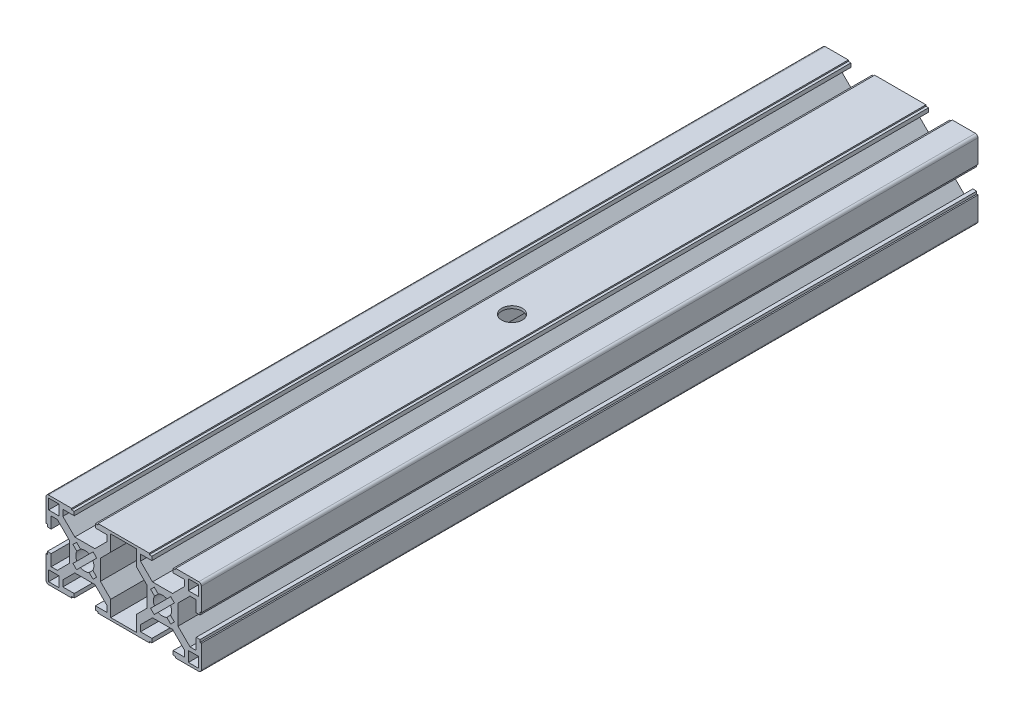
from build123d import *

# Parameters (mm, degrees)
ESBO_O1_W                      = 4
ESBO_O1_H                      = 4
RESSALTO_EXTRUS_O1_DEPTH       = 300
PADR_OCIRCULAR1_COUNT          = 4
PADR_O_LINEAR1_COUNT           = 2
PADR_O_LINEAR1_PITCH           = 30
PADR_O_LINEAR1_COPY_1_SKETCH_W = 4
PADR_O_LINEAR1_COPY_1_SKETCH_H = 4
PADR_O_LINEAR1_COPY_1_DEPTH    = 300
PADR_O_LINEAR1_COPY_2_SKETCH_W = 4
PADR_O_LINEAR1_COPY_2_SKETCH_H = 4
PADR_O_LINEAR1_COPY_2_DEPTH    = 300
PADR_O_LINEAR1_COPY_3_SKETCH_W = 4
PADR_O_LINEAR1_COPY_3_SKETCH_H = 4
PADR_O_LINEAR1_COPY_3_DEPTH    = 300
ESBO_O4_W                      = 10
ESBO_O4_H                      = 28
CORTE_EXTRUS_O1_DEPTH          = 304.72685097
FILETE1_R                      = 1
CUT_EXTRUDE1_DEPTH             = 305.836021494


with BuildPart() as part:
    # Esboço1 → Ressalto-extrusão1 (new body)
    with BuildSketch(Plane.XY):
        with BuildLine():
            ThreePointArc((-1.664601464, 3.078815026), (-0.858529967, 3.393070335), (0, 3.5))
            Line((0, 3.5), (0, 6))
            Line((0, 6), (-3.878679656, 6))
            Line((-3.878679656, 6), (-8.5, 10.621320344))
            Line((-8.5, 10.621320344), (-8.5, 13))
            Line((-8.5, 13), (-4.1, 13))
            Line((-4.1, 13), (-4.1, 14.5))
            Line((-4.1, 14.5), (-5.1, 14.5))
            Line((-5.1, 14.5), (-5.1, 15))
            Line((-5.1, 15), (-15, 15))
            Line((-15, 15), (-15, 5.1))
            Line((-15, 5.1), (-14.5, 5.1))
            Line((-14.5, 5.1), (-14.5, 4.1))
            Line((-14.5, 4.1), (-13, 4.1))
            Line((-13, 4.1), (-13, 8.5))
            Line((-13, 8.5), (-10.621320344, 8.5))
            Line((-10.621320344, 8.5), (-6, 3.878679656))
            Line((-6, 3.878679656), (-6, 0))
            Line((-6, 0), (-3.5, 0))
            ThreePointArc((-3.5, 0), (-3.393070335, 0.858529967), (-3.078815026, 1.664601464))
            Line((-3.078815026, 1.664601464), (-4.596194078, 3.181980515))
            Line((-4.596194078, 3.181980515), (-3.181980515, 4.596194078))
            Line((-3.181980515, 4.596194078), (-1.664601464, 3.078815026))
        make_face()
        with Locations((-12, 12)):
            Rectangle(ESBO_O1_W, ESBO_O1_H, mode=Mode.SUBTRACT)
    ressalto_extrus_o1 = extrude(amount=RESSALTO_EXTRUS_O1_DEPTH)

    # PadrãoCircular1: Ressalto-extrusão1 ×4 about axis
    padr_ocircular1_axis = Axis((0, 0, 0), (0, 0, 1))
    for i in range(1, PADR_OCIRCULAR1_COUNT):
        add(ressalto_extrus_o1.rotate(padr_ocircular1_axis, i * 360 / PADR_OCIRCULAR1_COUNT))

    # Padrão linear1: Ressalto-extrusão1 ×2
    with Locations(*[(i * PADR_O_LINEAR1_PITCH, 0, 0) for i in range(1, PADR_O_LINEAR1_COUNT)]):
        add(ressalto_extrus_o1)

    # Padrão linear1 copy 1 sketch → Padrão linear1 copy 1 (add)
    with BuildSketch(Plane(origin=(30, 0, 0), x_dir=(0, 1, 0), z_dir=(0, 0, 1))):
        with BuildLine():
            ThreePointArc((-1.664601464, 3.078815026), (-0.858529967, 3.393070335), (0, 3.5))
            Line((0, 3.5), (0, 6))
            Line((0, 6), (-3.878679656, 6))
            Line((-3.878679656, 6), (-8.5, 10.621320344))
            Line((-8.5, 10.621320344), (-8.5, 13))
            Line((-8.5, 13), (-4.1, 13))
            Line((-4.1, 13), (-4.1, 14.5))
            Line((-4.1, 14.5), (-5.1, 14.5))
            Line((-5.1, 14.5), (-5.1, 15))
            Line((-5.1, 15), (-15, 15))
            Line((-15, 15), (-15, 5.1))
            Line((-15, 5.1), (-14.5, 5.1))
            Line((-14.5, 5.1), (-14.5, 4.1))
            Line((-14.5, 4.1), (-13, 4.1))
            Line((-13, 4.1), (-13, 8.5))
            Line((-13, 8.5), (-10.621320344, 8.5))
            Line((-10.621320344, 8.5), (-6, 3.878679656))
            Line((-6, 3.878679656), (-6, 0))
            Line((-6, 0), (-3.5, 0))
            ThreePointArc((-3.5, 0), (-3.393070335, 0.858529967), (-3.078815026, 1.664601464))
            Line((-3.078815026, 1.664601464), (-4.596194078, 3.181980515))
            Line((-4.596194078, 3.181980515), (-3.181980515, 4.596194078))
            Line((-3.181980515, 4.596194078), (-1.664601464, 3.078815026))
        make_face()
        with Locations((-12, 12)):
            Rectangle(PADR_O_LINEAR1_COPY_1_SKETCH_W, PADR_O_LINEAR1_COPY_1_SKETCH_H, mode=Mode.SUBTRACT)
    extrude(amount=PADR_O_LINEAR1_COPY_1_DEPTH)

    # Padrão linear1 copy 2 sketch → Padrão linear1 copy 2 (add)
    with BuildSketch(Plane(origin=(30, 0, 0), x_dir=(-1, 0, 0), z_dir=(0, 0, 1))):
        with BuildLine():
            ThreePointArc((-1.664601464, 3.078815026), (-0.858529967, 3.393070335), (0, 3.5))
            Line((0, 3.5), (0, 6))
            Line((0, 6), (-3.878679656, 6))
            Line((-3.878679656, 6), (-8.5, 10.621320344))
            Line((-8.5, 10.621320344), (-8.5, 13))
            Line((-8.5, 13), (-4.1, 13))
            Line((-4.1, 13), (-4.1, 14.5))
            Line((-4.1, 14.5), (-5.1, 14.5))
            Line((-5.1, 14.5), (-5.1, 15))
            Line((-5.1, 15), (-15, 15))
            Line((-15, 15), (-15, 5.1))
            Line((-15, 5.1), (-14.5, 5.1))
            Line((-14.5, 5.1), (-14.5, 4.1))
            Line((-14.5, 4.1), (-13, 4.1))
            Line((-13, 4.1), (-13, 8.5))
            Line((-13, 8.5), (-10.621320344, 8.5))
            Line((-10.621320344, 8.5), (-6, 3.878679656))
            Line((-6, 3.878679656), (-6, 0))
            Line((-6, 0), (-3.5, 0))
            ThreePointArc((-3.5, 0), (-3.393070335, 0.858529967), (-3.078815026, 1.664601464))
            Line((-3.078815026, 1.664601464), (-4.596194078, 3.181980515))
            Line((-4.596194078, 3.181980515), (-3.181980515, 4.596194078))
            Line((-3.181980515, 4.596194078), (-1.664601464, 3.078815026))
        make_face()
        with Locations((-12, 12)):
            Rectangle(PADR_O_LINEAR1_COPY_2_SKETCH_W, PADR_O_LINEAR1_COPY_2_SKETCH_H, mode=Mode.SUBTRACT)
    extrude(amount=PADR_O_LINEAR1_COPY_2_DEPTH)

    # Padrão linear1 copy 3 sketch → Padrão linear1 copy 3 (add)
    with BuildSketch(Plane(origin=(30, 0, 0), x_dir=(0, -1, 0), z_dir=(0, 0, 1))):
        with BuildLine():
            ThreePointArc((-1.664601464, 3.078815026), (-0.858529967, 3.393070335), (0, 3.5))
            Line((0, 3.5), (0, 6))
            Line((0, 6), (-3.878679656, 6))
            Line((-3.878679656, 6), (-8.5, 10.621320344))
            Line((-8.5, 10.621320344), (-8.5, 13))
            Line((-8.5, 13), (-4.1, 13))
            Line((-4.1, 13), (-4.1, 14.5))
            Line((-4.1, 14.5), (-5.1, 14.5))
            Line((-5.1, 14.5), (-5.1, 15))
            Line((-5.1, 15), (-15, 15))
            Line((-15, 15), (-15, 5.1))
            Line((-15, 5.1), (-14.5, 5.1))
            Line((-14.5, 5.1), (-14.5, 4.1))
            Line((-14.5, 4.1), (-13, 4.1))
            Line((-13, 4.1), (-13, 8.5))
            Line((-13, 8.5), (-10.621320344, 8.5))
            Line((-10.621320344, 8.5), (-6, 3.878679656))
            Line((-6, 3.878679656), (-6, 0))
            Line((-6, 0), (-3.5, 0))
            ThreePointArc((-3.5, 0), (-3.393070335, 0.858529967), (-3.078815026, 1.664601464))
            Line((-3.078815026, 1.664601464), (-4.596194078, 3.181980515))
            Line((-4.596194078, 3.181980515), (-3.181980515, 4.596194078))
            Line((-3.181980515, 4.596194078), (-1.664601464, 3.078815026))
        make_face()
        with Locations((-12, 12)):
            Rectangle(PADR_O_LINEAR1_COPY_3_SKETCH_W, PADR_O_LINEAR1_COPY_3_SKETCH_H, mode=Mode.SUBTRACT)
    extrude(amount=PADR_O_LINEAR1_COPY_3_DEPTH)

    # Esboço4 → Corte-extrusão1 (cut, through all)
    with BuildSketch(Plane(origin=(0, 0, 0), x_dir=(-1, 0, 0), z_dir=(0, 0, -1))):
        with Locations((-15, 0)):
            Rectangle(ESBO_O4_W, ESBO_O4_H)
    extrude(amount=-CORTE_EXTRUS_O1_DEPTH, mode=Mode.SUBTRACT)

    # Filete1
    filete1_edges = [part.edges().sort_by_distance(p)[0] for p in [
        (45, -15, 150),
        (45, 15, 150),
        (-15, 15, 150),
        (-15, -15, 150),
    ]]
    fillet(filete1_edges, radius=FILETE1_R)

    # Sketch1 → Cut-Extrude1 (cut, through all)
    with BuildSketch(Plane(origin=(0, 15, 0), x_dir=(1, 0, 0), z_dir=(0, 1, 0))):
        with BuildLine():
            ThreePointArc((19, -150), (17.54586978, -146.914785735), (14.24072647, -146.072723118))
            Line((14.24072647, -146.072723118), (15.75927353, -153.927276882))
            ThreePointArc((15.75927353, -153.927276882), (18.085214265, -152.54586978), (19, -150))
        make_face()
        with BuildLine():
            Line((15.75927353, -153.927276882), (14.24072647, -146.072723118))
            ThreePointArc((14.24072647, -146.072723118), (11.072723118, -150.75927353), (15.75927353, -153.927276882))
        make_face()
    extrude(amount=-CUT_EXTRUDE1_DEPTH, mode=Mode.SUBTRACT)


solid = part.part
